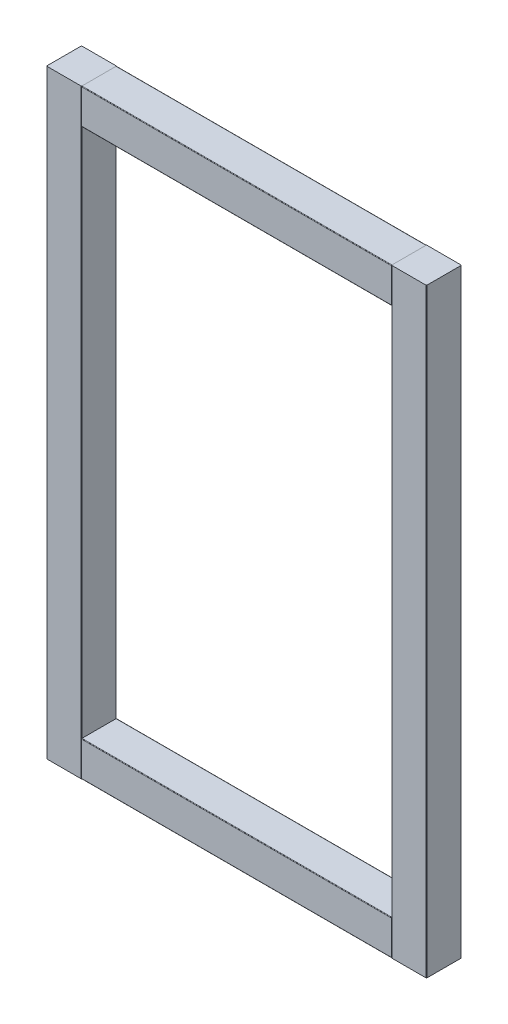
from build123d import *

# Parameters (mm, degrees)
CUSTOM_TASSEAU_CARRE_33_1_DEPTH      = 582.5
CUSTOM_TASSEAU_CARRE_33_1_DEPTH_BACK = 17.5
CUSTOM_TASSEAU_CARRE_33_1_2_DEPTH    = 600
CUSTOM_TASSEAU_CARRE_33_1_3_DEPTH    = 347
CUSTOM_TASSEAU_CARRE_33_1_4_DEPTH    = 347


with BuildPart() as part:
    # Esquisse14 → Custom TASSEAU-CARRE-33(1) (new, two sides: drawn at the far end of the back side and taken through both)
    with BuildSketch(Plane(origin=(172.5, -282.5, 0), x_dir=(-1, 0, 0), z_dir=(0, 1, 0)).offset(-CUSTOM_TASSEAU_CARRE_33_1_DEPTH_BACK)):
        with BuildLine():
            Line((-17, -17.5), (17, -17.5))
            ThreePointArc((17, -17.5), (17.353553391, -17.353553391), (17.5, -17))
            Line((17.5, -17), (17.5, 17))
            ThreePointArc((17.5, 17), (17.353553391, 17.353553391), (17, 17.5))
            Line((17, 17.5), (-17, 17.5))
            ThreePointArc((-17, 17.5), (-17.353553391, 17.353553391), (-17.5, 17))
            Line((-17.5, 17), (-17.5, -17))
            ThreePointArc((-17.5, -17), (-17.353553391, -17.353553391), (-17, -17.5))
        make_face()
    extrude(amount=CUSTOM_TASSEAU_CARRE_33_1_DEPTH + CUSTOM_TASSEAU_CARRE_33_1_DEPTH_BACK)


with BuildPart() as body_2:
    # Esquisse14 on segment 2 (carried to segment 2) → Custom TASSEAU-CARRE-33_1 2 (new body)
    with BuildSketch(Plane(origin=(-172.5, -300, 0), x_dir=(-1, 0, 0), z_dir=(0, 1, 0))):
        with BuildLine():
            Line((-17, -17.5), (17, -17.5))
            ThreePointArc((17, -17.5), (17.353553391, -17.353553391), (17.5, -17))
            Line((17.5, -17), (17.5, 17))
            ThreePointArc((17.5, 17), (17.353553391, 17.353553391), (17, 17.5))
            Line((17, 17.5), (-17, 17.5))
            ThreePointArc((-17, 17.5), (-17.353553391, 17.353553391), (-17.5, 17))
            Line((-17.5, 17), (-17.5, -17))
            ThreePointArc((-17.5, -17), (-17.353553391, -17.353553391), (-17, -17.5))
        make_face()
    extrude(amount=CUSTOM_TASSEAU_CARRE_33_1_2_DEPTH)


with BuildPart() as body_3:
    # Esquisse14 on segment 3 (carried to segment 3) → Custom TASSEAU-CARRE-33_1 3 (new body)
    with BuildSketch(Plane(origin=(173.5, 282.5, 0), x_dir=(0, -1, 0), z_dir=(-1, 0, 0))):
        with BuildLine():
            Line((-17, -17.5), (17, -17.5))
            ThreePointArc((17, -17.5), (17.353553391, -17.353553391), (17.5, -17))
            Line((17.5, -17), (17.5, 17))
            ThreePointArc((17.5, 17), (17.353553391, 17.353553391), (17, 17.5))
            Line((17, 17.5), (-17, 17.5))
            ThreePointArc((-17, 17.5), (-17.353553391, 17.353553391), (-17.5, 17))
            Line((-17.5, 17), (-17.5, -17))
            ThreePointArc((-17.5, -17), (-17.353553391, -17.353553391), (-17, -17.5))
        make_face()
    extrude(amount=CUSTOM_TASSEAU_CARRE_33_1_3_DEPTH)

    # Custom TASSEAU-CARRE-33_1 3 end butt 1
    split(bisect_by=Plane(origin=(155, 282.5, 0), x_dir=(0, -1, 0), z_dir=(-1, 0, 0)), keep=Keep.TOP)

    # Custom TASSEAU-CARRE-33_1 3 end butt 2
    split(bisect_by=Plane(origin=(-155, 282.5, 0), x_dir=(0, 1, 0), z_dir=(1, 0, 0)), keep=Keep.TOP)


with BuildPart() as body_4:
    # Esquisse14 on segment 4 (carried to segment 4) → Custom TASSEAU-CARRE-33_1 4 (new body)
    with BuildSketch(Plane(origin=(173.5, -282.5, 0), x_dir=(0, -1, 0), z_dir=(-1, 0, 0))):
        with BuildLine():
            Line((-17, -17.5), (17, -17.5))
            ThreePointArc((17, -17.5), (17.353553391, -17.353553391), (17.5, -17))
            Line((17.5, -17), (17.5, 17))
            ThreePointArc((17.5, 17), (17.353553391, 17.353553391), (17, 17.5))
            Line((17, 17.5), (-17, 17.5))
            ThreePointArc((-17, 17.5), (-17.353553391, 17.353553391), (-17.5, 17))
            Line((-17.5, 17), (-17.5, -17))
            ThreePointArc((-17.5, -17), (-17.353553391, -17.353553391), (-17, -17.5))
        make_face()
    extrude(amount=CUSTOM_TASSEAU_CARRE_33_1_4_DEPTH)

    # Custom TASSEAU-CARRE-33_1 4 end butt 1
    split(bisect_by=Plane(origin=(155, -282.5, 0), x_dir=(0, -1, 0), z_dir=(-1, 0, 0)), keep=Keep.TOP)

    # Custom TASSEAU-CARRE-33_1 4 end butt 2
    split(bisect_by=Plane(origin=(-155, -282.5, 0), x_dir=(0, 1, 0), z_dir=(1, 0, 0)), keep=Keep.TOP)


solid = Compound([part.part, body_2.part, body_3.part, body_4.part])
